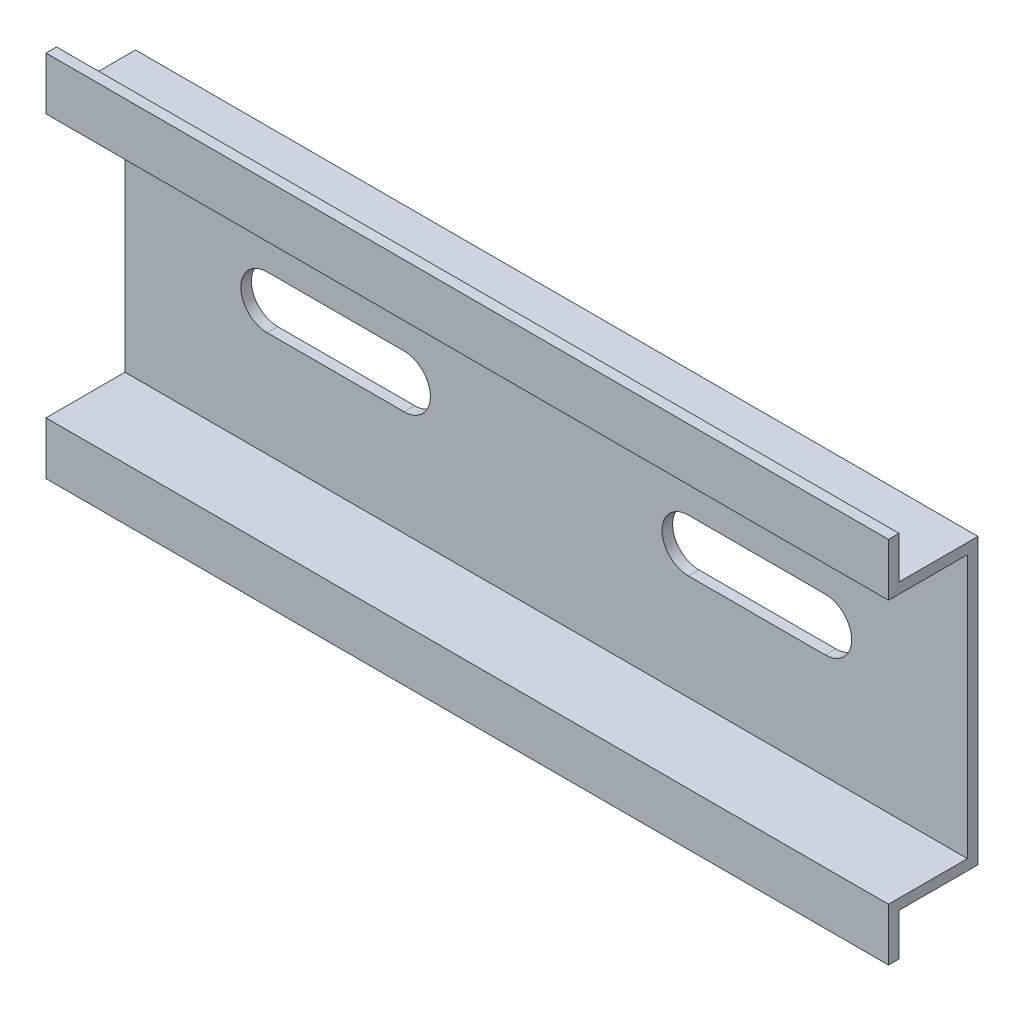
from build123d import *

# Parameters (mm, degrees)
ESTRUSIONE_ESTRUSIONE1_DEPTH = 80
TAGLIO_ESTRUSIONE1_REACH     = 89.643


with BuildPart() as part:
    # Schizzo1 → Estrusione-Estrusione1 (new body)
    with BuildSketch(Plane(origin=(0, 0, 0), x_dir=(0, 0, -1), z_dir=(1, 0, 0))):
        Polygon((0, 35), (0, 30), (7.5, 30), (7.5, 5), (0, 5), (0, 0), (1, 0), (1, 4), (8.5, 4), (8.5, 31), (1, 31), (1, 35), align=None)
    extrude(amount=ESTRUSIONE_ESTRUSIONE1_DEPTH)

    # Schizzo2 → Taglio-Estrusione1 (cut, up to next)
    with BuildSketch(Plane.XY.offset(-7.5), mode=Mode.PRIVATE) as taglio_estrusione1_sk1:
        with BuildLine():
            Line((13.5, 20), (26.5, 20))
            ThreePointArc((26.5, 20), (29, 17.5), (26.5, 15))
            Line((26.5, 15), (13.5, 15))
            ThreePointArc((13.5, 15), (11, 17.5), (13.5, 20))
        make_face()
    taglio_estrusione1_tool1 = extrude(taglio_estrusione1_sk1.sketch, amount=-TAGLIO_ESTRUSIONE1_REACH, mode=Mode.PRIVATE) & part.part
    # Schizzo2 → Taglio-Estrusione1 (cut, up to next)
    with BuildSketch(Plane.XY.offset(-7.5), mode=Mode.PRIVATE) as taglio_estrusione1_sk2:
        with BuildLine():
            Line((53.5, 20), (66.5, 20))
            ThreePointArc((66.5, 20), (69, 17.5), (66.5, 15))
            Line((66.5, 15), (53.5, 15))
            ThreePointArc((53.5, 15), (51, 17.5), (53.5, 20))
        make_face()
    taglio_estrusione1_tool2 = extrude(taglio_estrusione1_sk2.sketch, amount=-TAGLIO_ESTRUSIONE1_REACH, mode=Mode.PRIVATE) & part.part
    add(taglio_estrusione1_tool1.solids().sort_by_distance((20, 17.5, -7.5))[0], mode=Mode.SUBTRACT)
    add(taglio_estrusione1_tool2.solids().sort_by_distance((60, 17.5, -7.5))[0], mode=Mode.SUBTRACT)


solid = part.part
